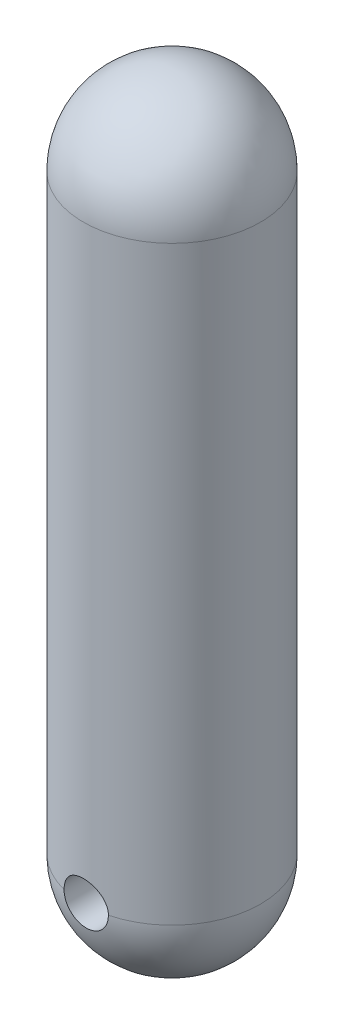
from build123d import *

# Parameters (mm, degrees)
SKETCH1_W               = 15
SKETCH1_H               = 100
CUT_EXTRUDE1_DEPTH      = 117.940155635
CUT_EXTRUDE1_DEPTH_BACK = 117.940155635
SKETCH2_R               = 3.75


with BuildPart() as part:
    # Sketch1 → Revolve1 (revolve)
    with BuildSketch(Plane.XY):
        with Locations((-7.5, 50)):
            Rectangle(SKETCH1_W, SKETCH1_H)
        with BuildLine():
            Line((-15, 100), (0, 100))
            Line((0, 100), (0, 115))
            ThreePointArc((0, 115), (-10.606601718, 110.606601718), (-15, 100))
        make_face()
        with BuildLine():
            Line((-15, 0), (0, 0))
            Line((0, 0), (0, -15))
            ThreePointArc((0, -15), (-10.606601718, -10.606601718), (-15, 0))
        make_face()
    revolve(axis=Axis((0, 0, 0), (0, 1, 0)))

    # Sketch2 → Cut-Extrude1 (cut, two sides: drawn at the far end of the back side and taken through both)
    with BuildSketch(Plane.XY.offset(-CUT_EXTRUDE1_DEPTH_BACK)):
        Circle(SKETCH2_R)
    extrude(amount=CUT_EXTRUDE1_DEPTH + CUT_EXTRUDE1_DEPTH_BACK, mode=Mode.SUBTRACT)


solid = part.part
